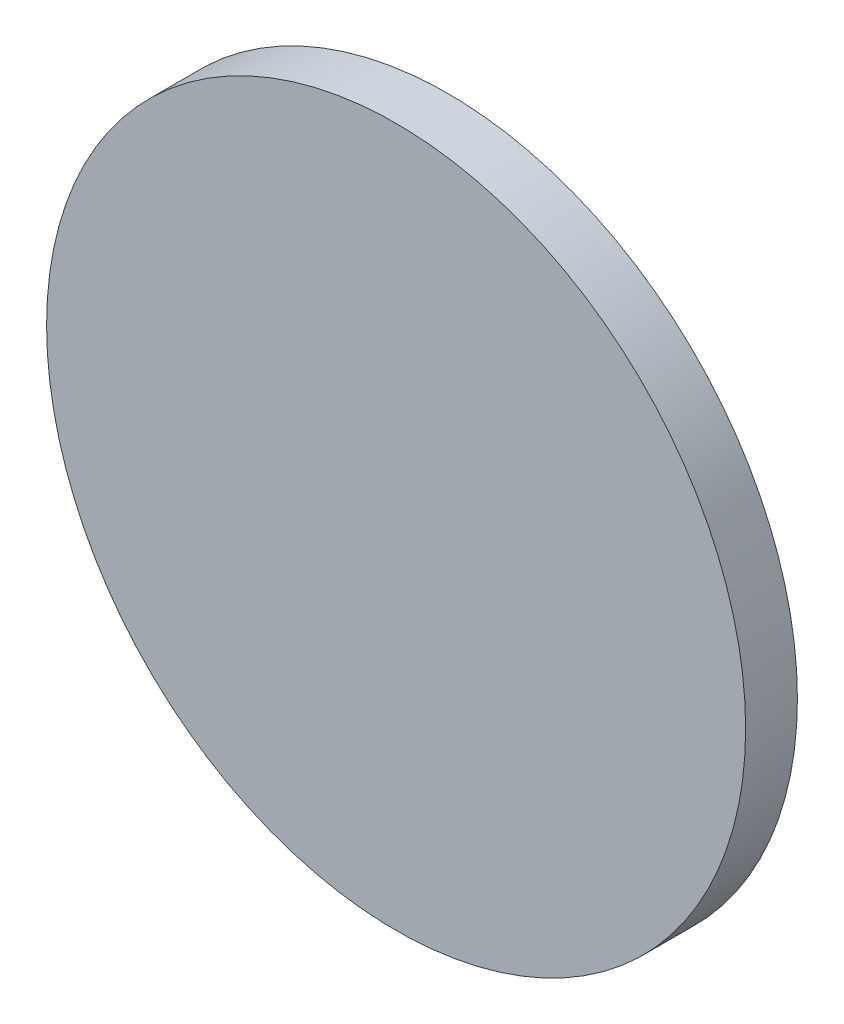
from build123d import *

# Parameters (mm, degrees)
SKETCH_1_R      = 27
YAW_TABLE_DEPTH = 4


with BuildPart() as part:
    # 草图1 → Yaw_Table (new body)
    with BuildSketch(Plane.XY):
        Circle(SKETCH_1_R)
    extrude(amount=YAW_TABLE_DEPTH)


solid = part.part
